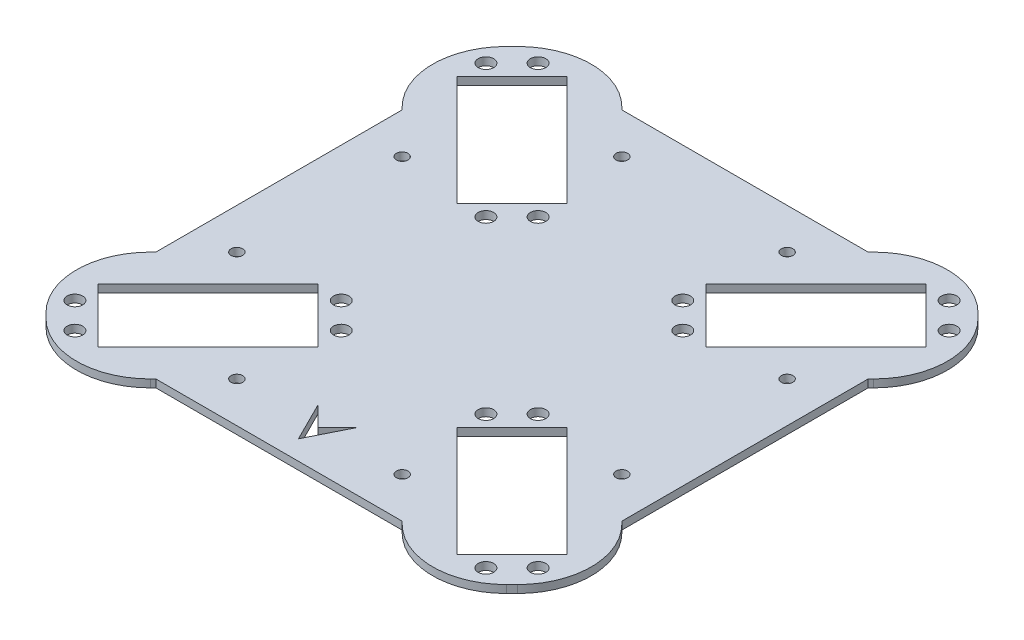
from build123d import *

# Parameters (mm, degrees)
SKETCH1_W           = 120
SKETCH1_H           = 120
BOSS_EXTRUDE1_DEPTH = 2
BOSS_EXTRUDE3_DEPTH = 2
SKETCH3_R           = 2
CUT_EXTRUDE1_DEPTH  = 2
FILLET1_R           = 19
SKETCH4_R           = 1.5
CUT_EXTRUDE2_DEPTH  = 2
CUT_EXTRUDE3_DEPTH  = 2


with BuildPart() as part:
    # Sketch1 → Boss-Extrude1 (new body)
    with BuildSketch(Plane(origin=(0, 0, 0), x_dir=(1, 0, 0), z_dir=(0, 1, 0))):
        with Locations((60, 60)):
            Rectangle(SKETCH1_W, SKETCH1_H)
    extrude(amount=BOSS_EXTRUDE1_DEPTH)

    # Sketch2 → Boss-Extrude3 (add)
    with BuildSketch(Plane(origin=(0, 2, 0), x_dir=(1, 0, 0), z_dir=(0, 1, 0))):
        Polygon((91.715728382, 120), (120, 91.715729123), (134.142135439, 105.857864931), (105.857863821, 134.142135809), align=None)
        Polygon((0, 91.715729123), (-14.142135439, 105.857864931), (14.142136179, 134.142135809), (28.284271618, 120), align=None)
        Polygon((28.284271618, 0), (0, 28.284270877), (-14.142135439, 14.142135069), (14.142136179, -14.142135809), align=None)
        Polygon((120, 28.284270877), (134.142135439, 14.142135069), (105.857863821, -14.142135809), (91.715728382, 0), align=None)
    extrude(amount=-BOSS_EXTRUDE3_DEPTH)

    # Sketch3 → Cut-Extrude1 (cut)
    with BuildSketch(Plane(origin=(0, 2, 0), x_dir=(1, 0, 0), z_dir=(0, 1, 0))):
        with Locations(Location((7.078140075, 0.360623351, 0), (0, 0, 270))):
            Circle(SKETCH3_R)
        with Locations(Location((0.360625566, 7.078137684, 0), (0, 0, 90))):
            Circle(SKETCH3_R)
        with Locations(Location((41.372818514, 34.655302687, 0), (0, 0, 90))):
            Circle(SKETCH3_R)
        with Locations(Location((34.655304005, 41.372817021, 0), (0, 0, 270))):
            Circle(SKETCH3_R)
        with Locations(Location((112.921859925, 0.360623351, 0), (0, 0, 90))):
            Circle(SKETCH3_R)
        with Locations(Location((119.639374434, 7.078137684, 0), (0, 0, 270))):
            Circle(SKETCH3_R)
        with Locations(Location((78.627181486, 34.655302687, 0), (0, 0, 270))):
            Circle(SKETCH3_R)
        with Locations(Location((85.344695995, 41.372817021, 0), (0, 0, 90))):
            Circle(SKETCH3_R)
        with Locations(Location((112.921859925, 119.639376649, 0), (0, 0, 270))):
            Circle(SKETCH3_R)
        with Locations(Location((119.639374434, 112.921862316, 0), (0, 0, 90))):
            Circle(SKETCH3_R)
        with Locations(Location((78.627181486, 85.344697313, 0), (0, 0, 90))):
            Circle(SKETCH3_R)
        with Locations(Location((85.344695995, 78.627182979, 0), (0, 0, 270))):
            Circle(SKETCH3_R)
        with Locations(Location((7.078140075, 119.639376649, 0), (0, 0, 90))):
            Circle(SKETCH3_R)
        with Locations(Location((0.360625566, 112.921862316, 0), (0, 0, 270))):
            Circle(SKETCH3_R)
        with Locations(Location((41.372818514, 85.344697313, 0), (0, 0, 270))):
            Circle(SKETCH3_R)
        with Locations(Location((34.655304005, 78.627182979, 0), (0, 0, 90))):
            Circle(SKETCH3_R)
        Polygon((13.795654506, -0.346483342), (42.079925383, 27.937788275), (27.937789574, 42.079923714), (-0.346481303, 13.795652096), align=None)
        Polygon((77.920074617, 27.937788275), (92.062210426, 42.079923714), (120.346481303, 13.795652096), (106.204345494, -0.346483342), align=None)
        Polygon((106.204345494, 120.346483342), (77.920074617, 92.062211725), (92.062210426, 77.920076286), (120.346481303, 106.204347904), align=None)
        Polygon((42.079925383, 92.062211725), (27.937789574, 77.920076286), (-0.346481303, 106.204347904), (13.795654506, 120.346483342), align=None)
    extrude(amount=-CUT_EXTRUDE1_DEPTH, mode=Mode.SUBTRACT)

    # Fillet1
    fillet1_edges = [part.edges().sort_by_distance(p)[0] for p in [
        (105.857863821, 1, -134.142135809),
        (134.142135439, 1, -105.857864931),
        (-14.142135439, 1, -105.857864931),
        (14.142136179, 1, -134.142135809),
        (14.142136179, 1, 14.142135809),
        (-14.142135439, 1, -14.142135069),
        (134.142135439, 1, -14.142135069),
        (105.857863821, 1, 14.142135809),
    ]]
    fillet(fillet1_edges, radius=FILLET1_R)

    # Sketch4 → Cut-Extrude2 (cut)
    with BuildSketch(Plane(origin=(0, 2, 0), x_dir=(1, 0, 0), z_dir=(0, 1, 0))):
        with Locations(Location((38.717632037, 10.433360693, 0), (0, 0, 270))):
            Circle(SKETCH4_R)
        with Locations(Location((10.43336208, 38.71762991, 0), (0, 0, 90))):
            Circle(SKETCH4_R)
        with Locations(Location((81.282367963, 10.433360693, 0), (0, 0, 90))):
            Circle(SKETCH4_R)
        with Locations(Location((109.56663792, 38.71762991, 0), (0, 0, 270))):
            Circle(SKETCH4_R)
        with Locations(Location((38.717632037, 109.566639307, 0), (0, 0, 90))):
            Circle(SKETCH4_R)
        with Locations(Location((10.43336208, 81.28237009, 0), (0, 0, 270))):
            Circle(SKETCH4_R)
        with Locations(Location((81.282367963, 109.566639307, 0), (0, 0, 270))):
            Circle(SKETCH4_R)
        with Locations(Location((109.56663792, 81.28237009, 0), (0, 0, 90))):
            Circle(SKETCH4_R)
    extrude(amount=-CUT_EXTRUDE2_DEPTH, mode=Mode.SUBTRACT)

    # Sketch5 → Cut-Extrude3 (cut)
    with BuildSketch(Plane(origin=(0, 2, 0), x_dir=(1, 0, 0), z_dir=(0, 1, 0))):
        Polygon((65, 15), (60, 10), (55, 15), (60, 5), align=None)
    extrude(amount=-CUT_EXTRUDE3_DEPTH, mode=Mode.SUBTRACT)


solid = part.part
